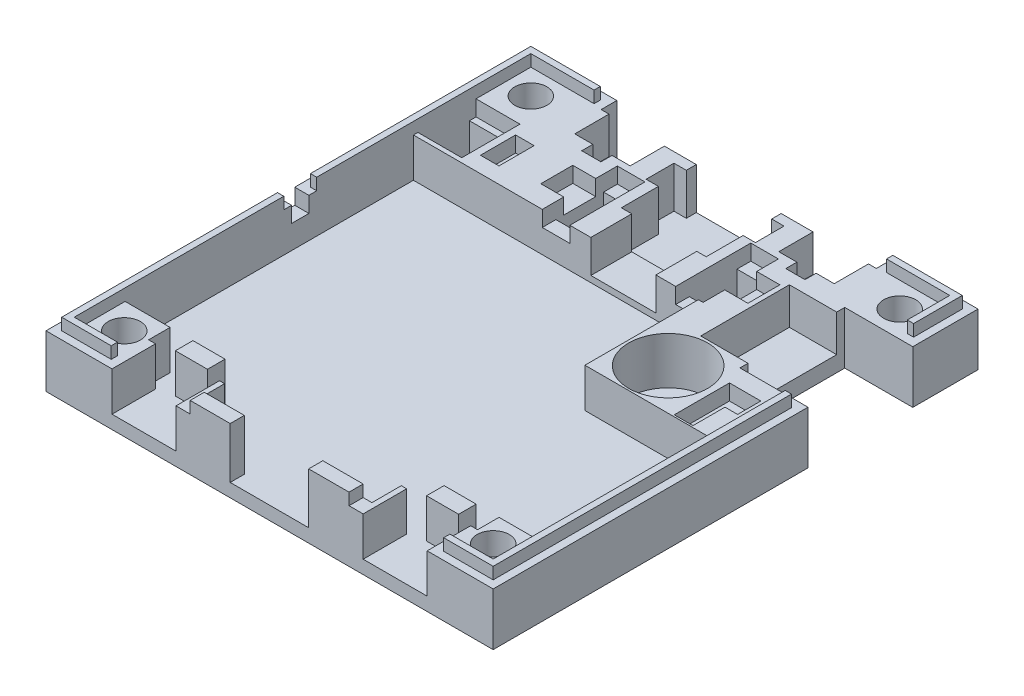
from build123d import *

# Parameters (mm, degrees)
SKETCH_1_W           = 56.974706629
SKETCH_1_H           = 61.774716789
EXTRUDE_1_DEPTH      = 6.7
SKETCH_2_W           = 8.669316727
SKETCH_2_H           = 13.354025908
CUT_EXTRUDE_1_DEPTH  = 57.923066884
SKETCH_3_W           = 6.025008901
SKETCH_3_H           = 11.3000508
CUT_EXTRUDE_2_DEPTH  = 4.7
SKETCH_4_R           = 5.03
CUT_EXTRUDE_3_DEPTH  = 6
SKETCH_5_R           = 1
CUT_EXTRUDE_4_DEPTH  = 57.923066884
CUT_EXTRUDE_5_DEPTH  = 2
CUT_EXTRUDE_6_DEPTH  = 2
SKETCH_8_W           = 3.513995428
SKETCH_8_H           = 6.075560276
CUT_EXTRUDE_7_DEPTH  = 57.923066884
SKETCH_9_W           = 7.063042926
SKETCH_9_H           = 4.362369824
CUT_EXTRUDE_8_DEPTH  = 4.7
SKETCH_10_W          = 2.4499365
SKETCH_10_H          = 1.42002794
CUT_EXTRUDE_9_DEPTH  = 2
SKETCH_11_W          = 35.063093726
SKETCH_11_H          = 2
CUT_EXTRUDE_10_DEPTH = 57.923066884
CUT_EXTRUDE_11_DEPTH = 5.3
SKETCH_13_W          = 8.286080772
SKETCH_13_H          = 5.236537973
CUT_EXTRUDE_12_DEPTH = 4.2
SKETCH_14_W          = 2.359613919
SKETCH_14_H          = 4.479603759
SKETCH_14_W_2        = 5.594310389
SKETCH_14_H_2        = 7.413106427
CUT_EXTRUDE_13_DEPTH = 2
SKETCH_15_W          = 5.594310389
SKETCH_15_H          = 5.734010668
CUT_EXTRUDE_14_DEPTH = 57.923066884
CUT_EXTRUDE_15_DEPTH = 5
SKETCH_18_W          = 8.154025908
SKETCH_18_H          = 6.040749301
CUT_EXTRUDE_16_DEPTH = 5
SKETCH_19_W          = 2.683012447
SKETCH_19_H          = 2.737564136
SKETCH_19_W_2        = 2.913081027
SKETCH_19_W_3        = 2.717012954
SKETCH_19_H_2        = 2.737561596
SKETCH_19_W_4        = 2.913081026
CUT_EXTRUDE_17_DEPTH = 5
EXTRUDE_4_DEPTH      = 1.5
SKETCH_25_R          = 2.05
CUT_EXTRUDE_18_DEPTH = 5
CUT_EXTRUDE_19_REACH = 74.547
SKETCH_26_W          = 2.2
SKETCH_26_H          = 2


with BuildPart() as part:
    # 草图1 → 凸台-拉伸1 (new body)
    with BuildSketch(Plane(origin=(0, 0, 0), x_dir=(1, 0, 0), z_dir=(0, 1, 0))):
        with Locations((6.805733636, 13.268542196)):
            Rectangle(SKETCH_1_W, SKETCH_1_H)
    extrude(amount=EXTRUDE_1_DEPTH)

    # 草图2 → 切除-拉伸1 (cut, through all)
    with BuildSketch(Plane(origin=(0, 6.7, 0), x_dir=(1, 0, 0), z_dir=(0, 1, 0))):
        with Locations((30.958428588, 29.168521876)):
            Rectangle(SKETCH_2_W, SKETCH_2_H)
    extrude(amount=-CUT_EXTRUDE_1_DEPTH, mode=Mode.SUBTRACT)

    # 草图3 → 切除-拉伸2 (cut)
    with BuildSketch(Plane(origin=(0, 6.7, 0), x_dir=(1, 0, 0), z_dir=(0, 1, 0))):
        with Locations((23.611265774, 29.168534576)):
            Rectangle(SKETCH_3_W, SKETCH_3_H)
    extrude(amount=-CUT_EXTRUDE_2_DEPTH, mode=Mode.SUBTRACT)

    # 草图4 → 切除-拉伸3 (cut)
    with BuildSketch(Plane(origin=(0, 6.7, 0), x_dir=(1, 0, 0), z_dir=(0, 1, 0))):
        with Locations(Location((21.805764117, 18.168422815, 0), (0, 0, 270))):
            Circle(SKETCH_4_R)
    extrude(amount=-CUT_EXTRUDE_3_DEPTH, mode=Mode.SUBTRACT)

    # 草图5 → 切除-拉伸4 (cut, through all)
    with BuildSketch(Plane(origin=(0, 6.7, 0), x_dir=(1, 0, 0), z_dir=(0, 1, 0))):
        with Locations(Location((21.805764117, 18.168422815, 0), (0, 0, 270))):
            Circle(SKETCH_5_R)
    extrude(amount=-CUT_EXTRUDE_4_DEPTH, mode=Mode.SUBTRACT)

    # 草图6 → 切除-拉伸5 (cut)
    with BuildSketch(Plane(origin=(0, 6.7, 0), x_dir=(1, 0, 0), z_dir=(0, 1, 0))):
        Polygon((29.999071203, 13.131206661), (27.61248243, 13.131206661), (27.61248243, 20.17096536), (31.608192362, 20.17096536), (31.608192362, 17.212011843), (29.999071203, 17.212011843), align=None)
    extrude(amount=-CUT_EXTRUDE_5_DEPTH, mode=Mode.SUBTRACT)

    # 草图7 → 切除-拉伸6 (cut)
    with BuildSketch(Plane(origin=(0, 6.7, 0), x_dir=(1, 0, 0), z_dir=(0, 1, 0))):
        Polygon((13.535748877, 27.373568866), (17.049744305, 27.373568866), (17.049744305, 30.131239681), (19.999050883, 30.131239681), (19.999050883, 34.20591583), (17.049744305, 34.20591583), (17.049744305, 36.963586646), (13.535748877, 36.963586646), align=None)
        Polygon((0.049708745, 27.373568866), (0.049708745, 36.963586646), (-3.464286683, 36.963586646), (-3.464286683, 34.20591583), (-6.38758361, 34.20591583), (-6.38758361, 30.131239681), (-3.464286683, 30.131239681), (-3.464286683, 27.373568866), align=None)
    extrude(amount=-CUT_EXTRUDE_6_DEPTH, mode=Mode.SUBTRACT)

    # 草图8 → 切除-拉伸7 (cut, through all)
    with BuildSketch(Plane(origin=(0, 6.7, 0), x_dir=(1, 0, 0), z_dir=(0, 1, 0))):
        with Locations((15.292746591, 32.16678949)):
            Rectangle(SKETCH_8_W, SKETCH_8_H)
        with Locations((-1.707288969, 32.16678949)):
            Rectangle(SKETCH_8_W, SKETCH_8_H)
    extrude(amount=-CUT_EXTRUDE_7_DEPTH, mode=Mode.SUBTRACT)

    # 草图9 → 切除-拉伸8 (cut)
    with BuildSketch(Plane(origin=(0, 6.7, 0), x_dir=(1, 0, 0), z_dir=(0, 1, 0))):
        with Locations((19.805886037, 39.974715678)):
            Rectangle(SKETCH_9_W, SKETCH_9_H)
        with Locations((-6.194164763, 39.974715678)):
            Rectangle(SKETCH_9_W, SKETCH_9_H)
    extrude(amount=-CUT_EXTRUDE_8_DEPTH, mode=Mode.SUBTRACT)

    # 草图10 → 切除-拉伸9 (cut)
    with BuildSketch(Plane(origin=(0, 6.7, 0), x_dir=(1, 0, 0), z_dir=(0, 1, 0))):
        with Locations((19.805759037, 37.083516796)):
            Rectangle(SKETCH_10_W, SKETCH_10_H)
        with Locations((-6.194291763, 37.083516796)):
            Rectangle(SKETCH_10_W, SKETCH_10_H)
    extrude(amount=-CUT_EXTRUDE_9_DEPTH, mode=Mode.SUBTRACT)

    # 草图11 → 切除-拉伸10 (cut, through all)
    with BuildSketch(Plane(origin=(0, 6.7, 0), x_dir=(1, 0, 0), z_dir=(0, 1, 0))):
        with Locations((6.805860637, 43.15590059)):
            Rectangle(SKETCH_11_W, SKETCH_11_H)
    extrude(amount=-CUT_EXTRUDE_10_DEPTH, mode=Mode.SUBTRACT)

    # 草图12 → 切除-拉伸11 (cut)
    with BuildSketch(Plane(origin=(0, 6.7, 0), x_dir=(1, 0, 0), z_dir=(0, 1, 0))):
        Polygon((12.21261705, 42.15590059), (12.21261705, 40.952697644), (13.78261959, 40.952697644), (13.78261959, 37.307917354), (12.21261705, 37.307917354), (12.21261705, 32.60558055), (1.398596223, 32.60558055), (1.398596223, 37.333317405), (-0.171406318, 37.333317405), (-0.171406318, 40.882923704), (1.400885865, 40.882923704), (1.400885865, 42.15590059), align=None)
    extrude(amount=-CUT_EXTRUDE_11_DEPTH, mode=Mode.SUBTRACT)

    # 草图13 → 切除-拉伸12 (cut)
    with BuildSketch(Plane(origin=(0, 6.7, 0), x_dir=(1, 0, 0), z_dir=(0, 1, 0))):
        with Locations((6.869233764, 29.987311564)):
            Rectangle(SKETCH_13_W, SKETCH_13_H)
    extrude(amount=-CUT_EXTRUDE_12_DEPTH, mode=Mode.SUBTRACT)

    # 草图14 → 切除-拉伸13 (cut)
    with BuildSketch(Plane(origin=(0, 6.7, 0), x_dir=(1, 0, 0), z_dir=(0, 1, 0))):
        with Locations((-12.194304463, 31.668577756)):
            Rectangle(SKETCH_14_W, SKETCH_14_H)
        with Locations((-17.084464483, 31.668577756)):
            Rectangle(SKETCH_14_W_2, SKETCH_14_H_2)
    extrude(amount=-CUT_EXTRUDE_13_DEPTH, mode=Mode.SUBTRACT)

    # 草图15 → 切除-拉伸14 (cut, through all)
    with BuildSketch(Plane(origin=(0, 6.7, 0), x_dir=(1, 0, 0), z_dir=(0, 1, 0))):
        with Locations((-17.084464483, 31.668653956)):
            Rectangle(SKETCH_15_W, SKETCH_15_H)
    extrude(amount=-CUT_EXTRUDE_14_DEPTH, mode=Mode.SUBTRACT)

    # 草图16 → 切除-拉伸15 (cut)
    with BuildSketch(Plane(origin=(0, 6.7, 0), x_dir=(1, 0, 0), z_dir=(0, 1, 0))):
        Polygon((16.449751925, 27.39556785), (-19.881619678, 27.39556785), (-19.881619678, -9.340502762), (-4.46782745, -9.340502762), (-4.46782745, -15.818816199), (1.788733383, -15.818816199), (1.788733383, -17.618816199), (11.788733383, -17.618816199), (11.788733383, -15.818816199), (18.045294216, -15.818816199), (18.045294216, -9.340505302), (33.493086951, -9.340505302), (33.493086951, 12.913538386), (16.449751925, 12.913538386), align=None)
    extrude(amount=-CUT_EXTRUDE_15_DEPTH, mode=Mode.SUBTRACT)

    # 草图18 → 切除-拉伸16 (cut)
    with BuildSketch(Plane(origin=(0, 6.7, 0), x_dir=(1, 0, 0), z_dir=(0, 1, 0))):
        with Locations((-9.194172383, -14.598441549)):
            Rectangle(SKETCH_18_W, SKETCH_18_H)
        with Locations((22.805893657, -14.598441549)):
            Rectangle(SKETCH_18_W, SKETCH_18_H)
    extrude(amount=-CUT_EXTRUDE_16_DEPTH, mode=Mode.SUBTRACT)

    # 草图19 → 切除-拉伸17 (cut)
    with BuildSketch(Plane(origin=(0, 6.7, 0), x_dir=(1, 0, 0), z_dir=(0, 1, 0))):
        with Locations((-5.809333674, -10.70928483)):
            Rectangle(SKETCH_19_W, SKETCH_19_H)
        with Locations((-12.694299384, -10.70928483)):
            Rectangle(SKETCH_19_W_2, SKETCH_19_H)
        with Locations((19.403800693, -10.7092861)):
            Rectangle(SKETCH_19_W_3, SKETCH_19_H_2)
        with Locations((26.305766657, -10.7092861)):
            Rectangle(SKETCH_19_W_4, SKETCH_19_H_2)
    extrude(amount=-CUT_EXTRUDE_17_DEPTH, mode=Mode.SUBTRACT)

    # 草图24 → 凸台-拉伸4 (add)
    with BuildSketch(Plane(origin=(0, 6.7, 0), x_dir=(1, 0, 0), z_dir=(0, 1, 0))):
        Polygon((-11.825686226, 42.35590059), (-19.881619678, 42.35590059), (-19.881619678, 15.076541942), (-20.681619678, 15.076541942), (-20.681619678, 43.15590059), (-11.825686226, 43.15590059), align=None)
        Polygon((-19.881619678, -15.818816199), (-14.371185337, -15.818816199), (-14.371185337, -16.618816199), (-20.681619678, -16.618816199), (-20.681619678, 10.876541942), (-19.881619678, 10.876541942), align=None)
        Polygon((33.493086951, -15.818816199), (33.493086951, 21.391508922), (34.293086951, 21.391508922), (34.293086951, -16.618816199), (27.982906611, -16.618816199), (27.982906611, -15.818816199), align=None)
        Polygon((33.493086951, 36.94553483), (33.493086951, 42.35590059), (25.4374075, 42.35590059), (25.4374075, 43.15590059), (34.293086951, 43.15590059), (34.293086951, 36.94553483), align=None)
        Polygon((1.788733383, -16.618816199), (1.788733383, -15.818816199), (-3.313915843, -15.818816199), (-3.313915843, -17.618816199), (1.788733383, -17.618816199), align=None)
        Polygon((11.788733383, -16.618816199), (11.788733383, -15.818816199), (16.925383116, -15.818816199), (16.925383116, -17.618816199), (11.788733383, -17.618816199), align=None)
    extrude(amount=EXTRUDE_4_DEPTH)

    # 草图25 → 切除-拉伸18 (cut)
    with BuildSketch(Plane(origin=(0, 6.7, 0), x_dir=(1, 0, 0), z_dir=(0, 1, 0))):
        with Locations(Location((30.305781897, -12.631511144, 0), (0, 0, 270))):
            Circle(SKETCH_25_R)
        with Locations(Location((-16.694314623, 39.168592996, 0), (0, 0, 270))):
            Circle(SKETCH_25_R)
        with Locations(Location((-16.694314623, -12.631511144, 0), (0, 0, 270))):
            Circle(SKETCH_25_R)
        with Locations(Location((30.305781897, 39.168592996, 0), (0, 0, 270))):
            Circle(SKETCH_25_R)
    extrude(amount=-CUT_EXTRUDE_18_DEPTH, mode=Mode.SUBTRACT)

    # 草图26 → 切除-拉伸19 (cut, up to next)
    with BuildSketch(Plane.ZY.offset(21.681619678), mode=Mode.PRIVATE) as cut_extrude_19_sk1:
        with Locations((-12.976541942, 5.7)):
            Rectangle(SKETCH_26_W, SKETCH_26_H)
    cut_extrude_19_tool1 = extrude(cut_extrude_19_sk1.sketch, amount=-CUT_EXTRUDE_19_REACH, mode=Mode.PRIVATE) & part.part
    add(cut_extrude_19_tool1.solids().sort_by_distance((-21.68162, 5.7, -12.976542))[0], mode=Mode.SUBTRACT)


solid = part.part
